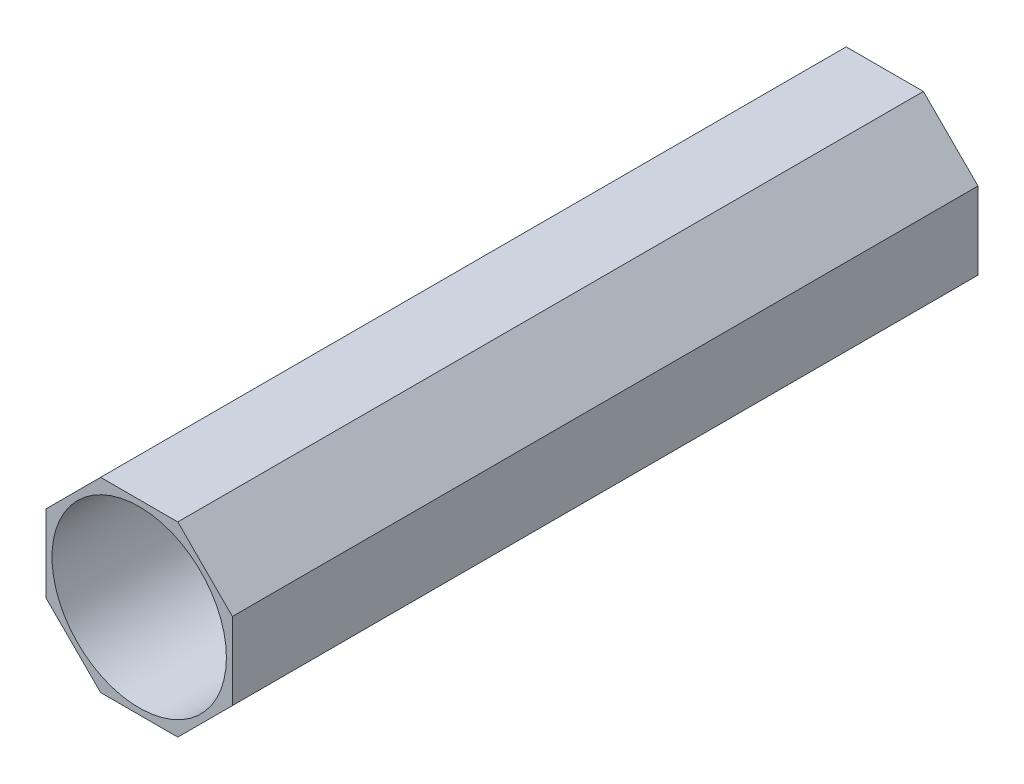
from build123d import *

# Parameters (mm, degrees)
SKETCH_1_R      = 15.95
SKETCH_1_R_2    = 14.05
EXTRUDE_1_DEPTH = 2
SKETCH_2_R      = 22.5
SKETCH_2_R_2    = 11
EXTRUDE_2_DEPTH = 50
SKETCH_3_R      = 21.05
EXTRUDE_3_DEPTH = 70
SKETCH_5_R      = 21.05
EXTRUDE_5_DEPTH = 40


with BuildPart() as part:
    # 스케치1 → 보스-돌출1 (new body)
    with BuildSketch(Plane.XY):
        Circle(SKETCH_1_R)
        Circle(SKETCH_1_R_2, mode=Mode.SUBTRACT)
    extrude(amount=-EXTRUDE_1_DEPTH)

    # 스케치2 → 보스-돌출2 (add)
    with BuildSketch(Plane.XY):
        Circle(SKETCH_2_R)
        Circle(SKETCH_2_R_2, mode=Mode.SUBTRACT)
    extrude(amount=EXTRUDE_2_DEPTH)

    # 스케치3 → 보스-돌출3 (add, symmetric)
    with BuildSketch(Plane.XY):
        Polygon((-9.319805153, -22.5), (9.319805153, -22.5), (22.5, -9.319805153), (22.5, 9.319805153), (9.319805153, 22.5), (-9.319805153, 22.5), (-22.5, 9.319805153), (-22.5, -9.319805153), align=None)
        Circle(SKETCH_3_R, mode=Mode.SUBTRACT)
    extrude(amount=EXTRUDE_3_DEPTH, both=True)

    # 스케치5 → 보스-돌출5 (add)
    with BuildSketch(Plane.XY.offset(70)):
        Polygon((-22.5, -9.319805153), (-9.319805153, -22.5), (9.319805153, -22.5), (22.5, -9.319805153), (22.5, 9.319805153), (9.319805153, 22.5), (-9.319805153, 22.5), (-22.5, 9.319805153), align=None)
        Circle(SKETCH_5_R, mode=Mode.SUBTRACT)
    extrude(amount=EXTRUDE_5_DEPTH)


solid = part.part
